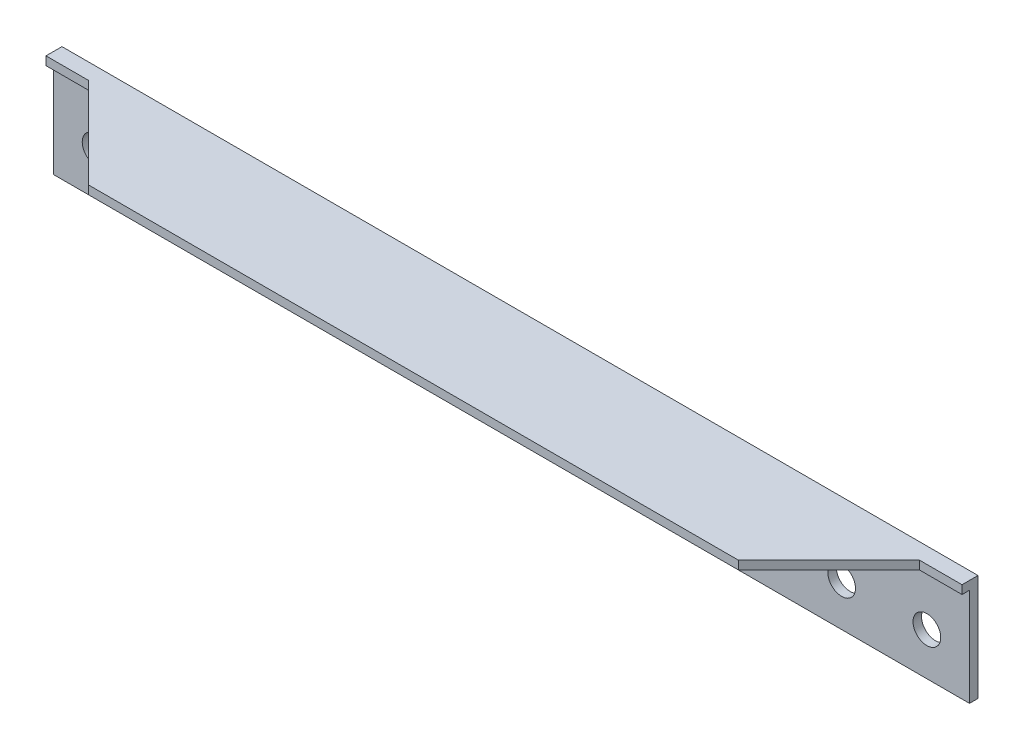
from build123d import *

# Parameters (mm, degrees)
SKETCH_1_W          = 860
SKETCH_1_H          = 100
SKETCH_1_R          = 13
EXTRUDE_1_DEPTH     = 8
SKETCH_2_W          = 860
SKETCH_2_H          = 8
EXTRUDE_2_DEPTH     = 92
CUT_EXTRUDE_1_DEPTH = 453.65881191


with BuildPart() as part:
    # 草图1 → 凸台-拉伸1 (new body)
    with BuildSketch(Plane.XY):
        with Locations((0, 50)):
            Rectangle(SKETCH_1_W, SKETCH_1_H)
        with Locations((390, 40)):
            Circle(SKETCH_1_R, mode=Mode.SUBTRACT)
        with Locations((310, 40)):
            Circle(SKETCH_1_R, mode=Mode.SUBTRACT)
        with Locations(Location((-390, 40, 0), (0, 0, 180))):
            Circle(SKETCH_1_R, mode=Mode.SUBTRACT)
        with Locations(Location((-310, 40, 0), (0, 0, 180))):
            Circle(SKETCH_1_R, mode=Mode.SUBTRACT)
    extrude(amount=EXTRUDE_1_DEPTH)

    # 草图2 → 凸台-拉伸2 (add)
    with BuildSketch(Plane.XY.offset(8)):
        with Locations((0, 96)):
            Rectangle(SKETCH_2_W, SKETCH_2_H)
    extrude(amount=EXTRUDE_2_DEPTH)

    # 草图4 → 切除-拉伸1 (cut, through all)
    with BuildSketch(Plane(origin=(0, 100, 0), x_dir=(1, 0, 0), z_dir=(0, 1, 0))):
        Polygon((-430, -15), (-390, -15), (-305, -100), (-430, -100), align=None)
    cut_extrude_1 = extrude(amount=-CUT_EXTRUDE_1_DEPTH, mode=Mode.SUBTRACT)

    # 镜向1: 切除-拉伸1 across plane
    add(cut_extrude_1.mirror(Plane(origin=(0, 0, 0), x_dir=(0, 0, 1), z_dir=(1, 0, 0))), mode=Mode.SUBTRACT)


solid = part.part
